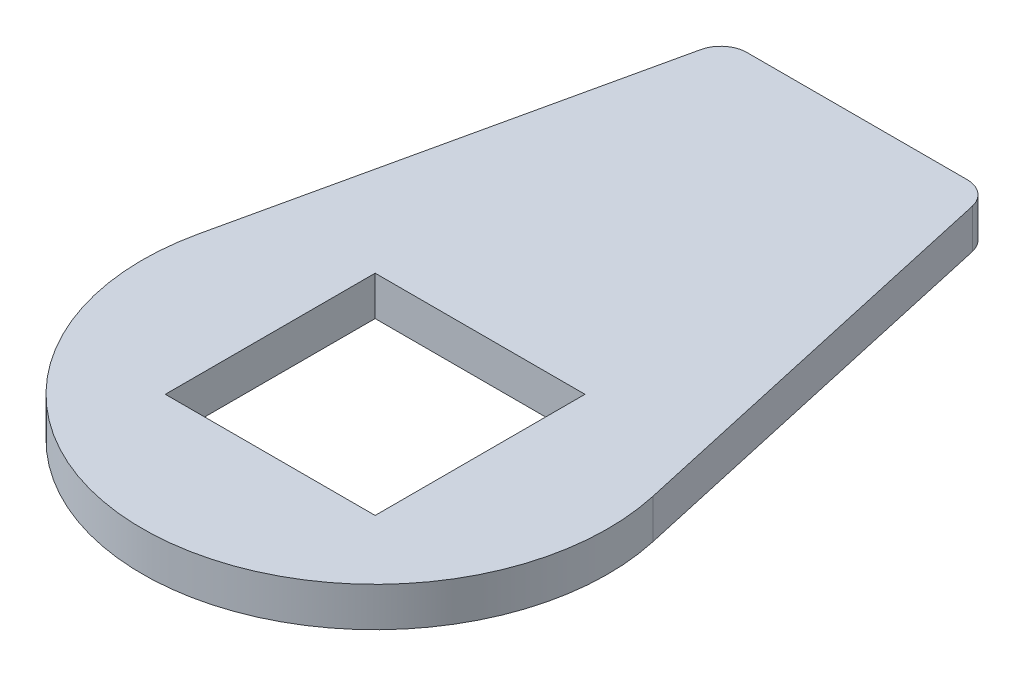
from build123d import *

# Parameters (mm, degrees)
BOSS_EXTRUDE1_DEPTH = 3
SKETCH2_W           = 16
SKETCH2_H           = 16
CUT_EXTRUDE1_DEPTH  = 3


with BuildPart() as part:
    # Sketch1 → Boss-Extrude1 (new body)
    with BuildSketch(Plane(origin=(0, 0, 0), x_dir=(1, 0, 0), z_dir=(0, 1, 0))):
        with BuildLine():
            Line((-8.396433729, 36.75), (8.396433729, 36.75))
            ThreePointArc((8.396433729, 36.75), (9.647519653, 36.310379445), (10.348602488, 35.184784011))
            Line((10.348602488, 35.184784011), (17.325497736, 3.858708099))
            ThreePointArc((17.325497736, 3.858708099), (0, -17.75), (-17.325497736, 3.858708099))
            Line((-17.325497736, 3.858708099), (-10.348602488, 35.184784011))
            ThreePointArc((-10.348602488, 35.184784011), (-9.647519653, 36.310379445), (-8.396433729, 36.75))
        make_face()
    extrude(amount=BOSS_EXTRUDE1_DEPTH)

    # Sketch2 → Cut-Extrude1 (cut)
    with BuildSketch(Plane(origin=(0, 3, 0), x_dir=(1, 0, 0), z_dir=(0, 1, 0))):
        Rectangle(SKETCH2_W, SKETCH2_H)
    extrude(amount=-CUT_EXTRUDE1_DEPTH, mode=Mode.SUBTRACT)


solid = part.part
